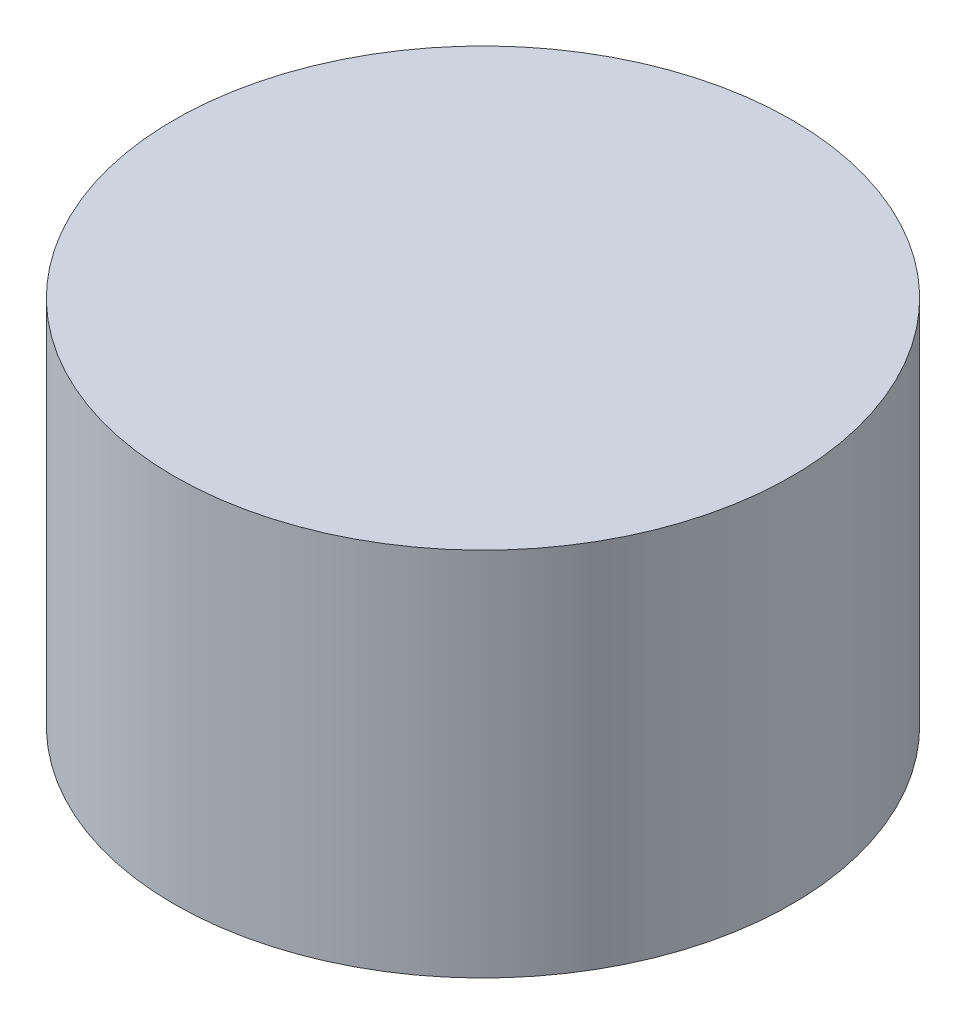
from build123d import *

# Parameters (mm, degrees)
SKIZZE2_R                       = 250
AUFSATZ_LINEAR_AUSTRAGEN1_DEPTH = 300


with BuildPart() as part:
    # Skizze2 → Aufsatz-Linear austragen1 (new body)
    with BuildSketch(Plane(origin=(0, 0, 0), x_dir=(1, 0, 0), z_dir=(0, 1, 0))):
        with Locations(Location((0, 0, 0), (0, 0, 270))):
            Circle(SKIZZE2_R)
    extrude(amount=AUFSATZ_LINEAR_AUSTRAGEN1_DEPTH)


solid = part.part
